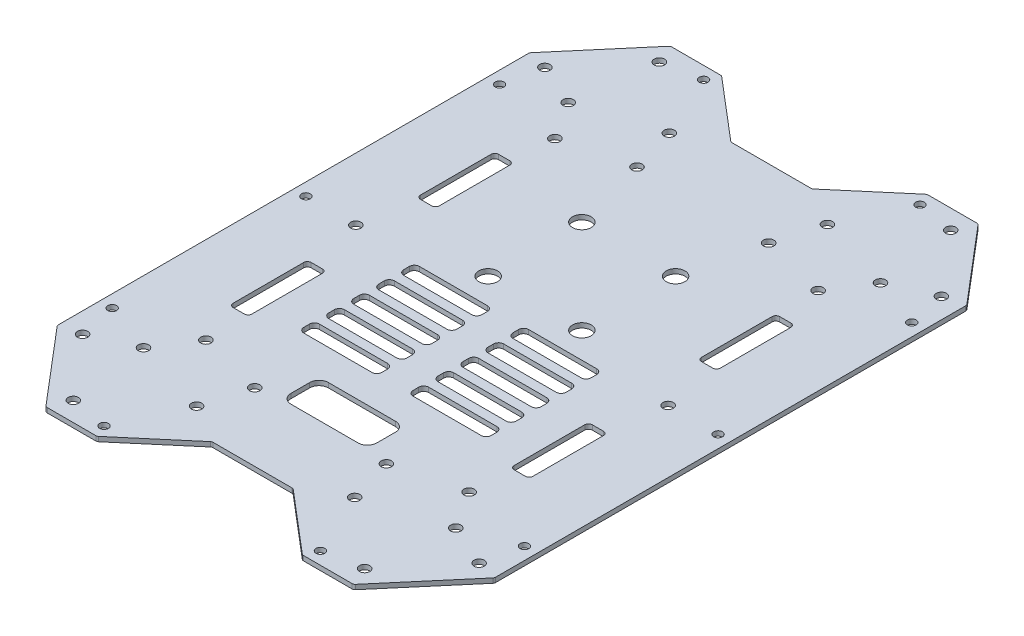
from build123d import *

# Parameters (mm, degrees)
BOSS_EXTRUDE1_DEPTH = 1.5
CUT_EXTRUDE1_DEPTH  = 123.074772169
SKETCH3_R           = 1.65
CUT_EXTRUDE2_DEPTH  = 123.074772169
SKETCH5_R           = 1.65
SKETCH5_R_2         = 3
CUT_EXTRUDE5_DEPTH  = 123.074772169
SKETCH6_R           = 1.65
CUT_EXTRUDE6_DEPTH  = 123.074772169
SKETCH7_R           = 1.4
CUT_EXTRUDE7_DEPTH  = 123.074772169
CUT_EXTRUDE10_DEPTH = 123.074772169
CUT_EXTRUDE11_DEPTH = 123.074772169
FILLET1_R           = 1


with BuildPart() as part:
    # Sketch1 → Boss-Extrude1 (new body)
    with BuildSketch(Plane(origin=(0, 0, 0), x_dir=(1, 0, 0), z_dir=(0, 1, 0))):
        Polygon((49.274817408, 100), (-49.274817408, 100), (-70, 75.618310015), (-70, -75.618310015), (-49.274817408, -100), (49.274817408, -100), (70, -75.618310015), (70, 75.618310015), align=None)
    extrude(amount=BOSS_EXTRUDE1_DEPTH)

    # Sketch2 → Cut-Extrude1 (cut, through all)
    with BuildSketch(Plane(origin=(0, 0, 0), x_dir=(1, 0, 0), z_dir=(0, 1, 0))):
        with BuildLine():
            Line((42, 18.7), (42, 41.3))
            ThreePointArc((42, 41.3), (42.351471863, 42.148528137), (43.2, 42.5))
            Line((43.2, 42.5), (46.8, 42.5))
            ThreePointArc((46.8, 42.5), (47.648528137, 42.148528137), (48, 41.3))
            Line((48, 41.3), (48, 18.7))
            ThreePointArc((48, 18.7), (47.648528137, 17.851471863), (46.8, 17.5))
            Line((46.8, 17.5), (43.2, 17.5))
            ThreePointArc((43.2, 17.5), (42.351471863, 17.851471863), (42, 18.7))
        make_face()
        with BuildLine():
            Line((-48, 18.7), (-48, 41.3))
            ThreePointArc((-48, 41.3), (-47.648528137, 42.148528137), (-46.8, 42.5))
            Line((-46.8, 42.5), (-43.2, 42.5))
            ThreePointArc((-43.2, 42.5), (-42.351471863, 42.148528137), (-42, 41.3))
            Line((-42, 41.3), (-42, 18.7))
            ThreePointArc((-42, 18.7), (-42.351471863, 17.851471863), (-43.2, 17.5))
            Line((-43.2, 17.5), (-46.8, 17.5))
            ThreePointArc((-46.8, 17.5), (-47.648528137, 17.851471863), (-48, 18.7))
        make_face()
        with BuildLine():
            Line((-46.8, -42.5), (-43.2, -42.5))
            ThreePointArc((-43.2, -42.5), (-42.351471863, -42.148528137), (-42, -41.3))
            Line((-42, -41.3), (-42, -18.7))
            ThreePointArc((-42, -18.7), (-42.351471863, -17.851471863), (-43.2, -17.5))
            Line((-43.2, -17.5), (-46.8, -17.5))
            ThreePointArc((-46.8, -17.5), (-47.648528137, -17.851471863), (-48, -18.7))
            Line((-48, -18.7), (-48, -41.3))
            ThreePointArc((-48, -41.3), (-47.648528137, -42.148528137), (-46.8, -42.5))
        make_face()
        with BuildLine():
            Line((43.2, -42.5), (46.8, -42.5))
            ThreePointArc((46.8, -42.5), (47.648528137, -42.148528137), (48, -41.3))
            Line((48, -41.3), (48, -18.7))
            ThreePointArc((48, -18.7), (47.648528137, -17.851471863), (46.8, -17.5))
            Line((46.8, -17.5), (43.2, -17.5))
            ThreePointArc((43.2, -17.5), (42.351471863, -17.851471863), (42, -18.7))
            Line((42, -18.7), (42, -41.3))
            ThreePointArc((42, -41.3), (42.351471863, -42.148528137), (43.2, -42.5))
        make_face()
    extrude(amount=CUT_EXTRUDE1_DEPTH, mode=Mode.SUBTRACT)

    # Sketch3 → Cut-Extrude2 (cut, through all)
    with BuildSketch(Plane(origin=(0, 0, 0), x_dir=(1, 0, 0), z_dir=(0, 1, 0))):
        with Locations(Location((-25.312257667, -75.69371006, 0), (0, 0, 270))):
            Circle(SKETCH3_R)
        with Locations(Location((-46.646236404, -93.828244828, 0), (0, 0, 270))):
            Circle(SKETCH3_R)
        with Locations(Location((-63.48544726, -74.018121715, 0), (0, 0, 270))):
            Circle(SKETCH3_R)
        with Locations(Location((-42.151468523, -55.883586947, 0), (0, 0, 270))):
            Circle(SKETCH3_R)
        with Locations(Location((25.312257667, -75.69371006, 0), (0, 0, 270))):
            Circle(SKETCH3_R)
        with Locations(Location((46.646236404, -93.828244828, 0), (0, 0, 270))):
            Circle(SKETCH3_R)
        with Locations(Location((63.48544726, -74.018121715, 0), (0, 0, 270))):
            Circle(SKETCH3_R)
        with Locations(Location((42.151468523, -55.883586947, 0), (0, 0, 270))):
            Circle(SKETCH3_R)
        with Locations(Location((42.151468523, 55.883586947, 0), (0, 0, 270))):
            Circle(SKETCH3_R)
        with Locations(Location((63.48544726, 74.018121715, 0), (0, 0, 270))):
            Circle(SKETCH3_R)
        with Locations(Location((46.646236404, 93.828244828, 0), (0, 0, 270))):
            Circle(SKETCH3_R)
        with Locations(Location((25.312257667, 75.69371006, 0), (0, 0, 270))):
            Circle(SKETCH3_R)
        with Locations(Location((-25.312257667, 75.69371006, 0), (0, 0, 270))):
            Circle(SKETCH3_R)
        with Locations(Location((-42.151468523, 55.883586947, 0), (0, 0, 270))):
            Circle(SKETCH3_R)
        with Locations(Location((-63.48544726, 74.018121715, 0), (0, 0, 270))):
            Circle(SKETCH3_R)
        with Locations(Location((-46.646236404, 93.828244828, 0), (0, 0, 270))):
            Circle(SKETCH3_R)
    extrude(amount=CUT_EXTRUDE2_DEPTH, mode=Mode.SUBTRACT)

    # Sketch5 → Cut-Extrude5 (cut, through all)
    with BuildSketch(Plane(origin=(0, 0, 0), x_dir=(1, 0, 0), z_dir=(0, 1, 0))):
        with Locations(Location((21.059, -61.294231, 0), (0, 0, 270))):
            Circle(SKETCH5_R)
        with Locations(Location((-21.105, -61.294231, 0), (0, 0, 270))):
            Circle(SKETCH5_R)
        with Locations(Location((21.059, 61.133769, 0), (0, 0, 270))):
            Circle(SKETCH5_R)
        with Locations(Location((-21.105, 61.133769, 0), (0, 0, 270))):
            Circle(SKETCH5_R)
        with Locations(Location((15.358, 37.017769, 0), (0, 0, 270))):
            Circle(SKETCH5_R_2)
        with Locations(Location((-14.642, 37.017769, 0), (0, 0, 270))):
            Circle(SKETCH5_R_2)
        with Locations(Location((-14.642, 7.017769, 0), (0, 0, 270))):
            Circle(SKETCH5_R_2)
        with Locations(Location((15.358, 7.017769, 0), (0, 0, 270))):
            Circle(SKETCH5_R_2)
    extrude(amount=CUT_EXTRUDE5_DEPTH, mode=Mode.SUBTRACT)

    # Sketch6 → Cut-Extrude6 (cut, through all)
    with BuildSketch(Plane(origin=(0, 0, 0), x_dir=(1, 0, 0), z_dir=(0, 1, 0))):
        with Locations(Location((-50, 0, 0), (0, 0, 270))):
            Circle(SKETCH6_R)
        with Locations(Location((-50, -68, 0), (0, 0, 270))):
            Circle(SKETCH6_R)
        with Locations(Location((-50, 68, 0), (0, 0, 270))):
            Circle(SKETCH6_R)
        with Locations(Location((50, 68, 0), (0, 0, 90))):
            Circle(SKETCH6_R)
        with Locations(Location((50, -68, 0), (0, 0, 90))):
            Circle(SKETCH6_R)
        with Locations(Location((50, 0, 0), (0, 0, 90))):
            Circle(SKETCH6_R)
    extrude(amount=CUT_EXTRUDE6_DEPTH, mode=Mode.SUBTRACT)

    # Sketch7 → Cut-Extrude7 (cut, through all)
    with BuildSketch(Plane(origin=(0, 0, 0), x_dir=(1, 0, 0), z_dir=(0, 1, 0))):
        with Locations(Location((-34.646236404, -96, 0), (0, 0, 270))):
            Circle(SKETCH7_R)
        with Locations(Location((-66, -62.018121715, 0), (0, 0, 270))):
            Circle(SKETCH7_R)
        with Locations(Location((-66, 0, 0), (0, 0, 270))):
            Circle(SKETCH7_R)
        with Locations(Location((-66, 62.018121715, 0), (0, 0, 270))):
            Circle(SKETCH7_R)
        with Locations(Location((-34.646236404, 96, 0), (0, 0, 270))):
            Circle(SKETCH7_R)
        with Locations(Location((0, 96, 0), (0, 0, 270))):
            Circle(SKETCH7_R)
        with Locations(Location((0, -96, 0), (0, 0, 270))):
            Circle(SKETCH7_R)
        with Locations(Location((34.646236404, 96, 0), (0, 0, 90))):
            Circle(SKETCH7_R)
        with Locations(Location((66, 62.018121715, 0), (0, 0, 90))):
            Circle(SKETCH7_R)
        with Locations(Location((66, 0, 0), (0, 0, 90))):
            Circle(SKETCH7_R)
        with Locations(Location((66, -62.018121715, 0), (0, 0, 90))):
            Circle(SKETCH7_R)
        with Locations(Location((34.646236404, -96, 0), (0, 0, 90))):
            Circle(SKETCH7_R)
    extrude(amount=CUT_EXTRUDE7_DEPTH, mode=Mode.SUBTRACT)

    # Sketch10 → Cut-Extrude10 (cut, through all)
    with BuildSketch(Plane(origin=(0, 0, 0), x_dir=(1, 0, 0), z_dir=(0, 1, 0))):
        with BuildLine():
            Line((-5, -10.869802471), (-5, -12.669802471))
            ThreePointArc((-5, -12.669802471), (-5.46862915, -13.801173321), (-6.6, -14.269802471))
            Line((-6.6, -14.269802471), (-28.4, -14.269802471))
            ThreePointArc((-28.4, -14.269802471), (-29.53137085, -13.801173321), (-30, -12.669802471))
            Line((-30, -12.669802471), (-30, -10.869802471))
            ThreePointArc((-30, -10.869802471), (-29.53137085, -9.738431622), (-28.4, -9.269802471))
            Line((-28.4, -9.269802471), (-6.6, -9.269802471))
            ThreePointArc((-6.6, -9.269802471), (-5.46862915, -9.738431622), (-5, -10.869802471))
        make_face()
        with BuildLine():
            Line((-10.75, -60.040539818), (10.75, -60.040539818))
            ThreePointArc((10.75, -60.040539818), (12.871320344, -59.161860162), (13.75, -57.040539818))
            Line((13.75, -57.040539818), (13.75, -51.040539818))
            ThreePointArc((13.75, -51.040539818), (12.871320344, -48.919219475), (10.75, -48.040539818))
            Line((10.75, -48.040539818), (-10.75, -48.040539818))
            ThreePointArc((-10.75, -48.040539818), (-12.871320344, -48.919219475), (-13.75, -51.040539818))
            Line((-13.75, -51.040539818), (-13.75, -57.040539818))
            ThreePointArc((-13.75, -57.040539818), (-12.871320344, -59.161860162), (-10.75, -60.040539818))
        make_face()
        with BuildLine():
            Line((-6.6, -1.269802471), (-28.4, -1.269802471))
            ThreePointArc((-28.4, -1.269802471), (-29.53137085, -1.738431622), (-30, -2.869802471))
            Line((-30, -2.869802471), (-30, -4.669802471))
            ThreePointArc((-30, -4.669802471), (-29.53137085, -5.801173321), (-28.4, -6.269802471))
            Line((-28.4, -6.269802471), (-6.6, -6.269802471))
            ThreePointArc((-6.6, -6.269802471), (-5.46862915, -5.801173321), (-5, -4.669802471))
            Line((-5, -4.669802471), (-5, -2.869802471))
            ThreePointArc((-5, -2.869802471), (-5.46862915, -1.738431622), (-6.6, -1.269802471))
        make_face()
        with BuildLine():
            Line((-5, -18.869802471), (-5, -20.669802471))
            ThreePointArc((-5, -20.669802471), (-5.46862915, -21.801173321), (-6.6, -22.269802471))
            Line((-6.6, -22.269802471), (-28.4, -22.269802471))
            ThreePointArc((-28.4, -22.269802471), (-29.53137085, -21.801173321), (-30, -20.669802471))
            Line((-30, -20.669802471), (-30, -18.869802471))
            ThreePointArc((-30, -18.869802471), (-29.53137085, -17.738431622), (-28.4, -17.269802471))
            Line((-28.4, -17.269802471), (-6.6, -17.269802471))
            ThreePointArc((-6.6, -17.269802471), (-5.46862915, -17.738431622), (-5, -18.869802471))
        make_face()
        with BuildLine():
            Line((-5, -26.869802471), (-5, -28.669802471))
            ThreePointArc((-5, -28.669802471), (-5.46862915, -29.801173321), (-6.6, -30.269802471))
            Line((-6.6, -30.269802471), (-28.4, -30.269802471))
            ThreePointArc((-28.4, -30.269802471), (-29.53137085, -29.801173321), (-30, -28.669802471))
            Line((-30, -28.669802471), (-30, -26.869802471))
            ThreePointArc((-30, -26.869802471), (-29.53137085, -25.738431622), (-28.4, -25.269802471))
            Line((-28.4, -25.269802471), (-6.6, -25.269802471))
            ThreePointArc((-6.6, -25.269802471), (-5.46862915, -25.738431622), (-5, -26.869802471))
        make_face()
        with BuildLine():
            Line((-5, -34.869802471), (-5, -36.669802471))
            ThreePointArc((-5, -36.669802471), (-5.46862915, -37.801173321), (-6.6, -38.269802471))
            Line((-6.6, -38.269802471), (-28.4, -38.269802471))
            ThreePointArc((-28.4, -38.269802471), (-29.53137085, -37.801173321), (-30, -36.669802471))
            Line((-30, -36.669802471), (-30, -34.869802471))
            ThreePointArc((-30, -34.869802471), (-29.53137085, -33.738431622), (-28.4, -33.269802471))
            Line((-28.4, -33.269802471), (-6.6, -33.269802471))
            ThreePointArc((-6.6, -33.269802471), (-5.46862915, -33.738431622), (-5, -34.869802471))
        make_face()
        with BuildLine():
            Line((6.6, -38.269802471), (28.4, -38.269802471))
            ThreePointArc((28.4, -38.269802471), (29.53137085, -37.801173321), (30, -36.669802471))
            Line((30, -36.669802471), (30, -34.869802471))
            ThreePointArc((30, -34.869802471), (29.53137085, -33.738431622), (28.4, -33.269802471))
            Line((28.4, -33.269802471), (6.6, -33.269802471))
            ThreePointArc((6.6, -33.269802471), (5.46862915, -33.738431622), (5, -34.869802471))
            Line((5, -34.869802471), (5, -36.669802471))
            ThreePointArc((5, -36.669802471), (5.46862915, -37.801173321), (6.6, -38.269802471))
        make_face()
        with BuildLine():
            Line((6.6, -30.269802471), (28.4, -30.269802471))
            ThreePointArc((28.4, -30.269802471), (29.53137085, -29.801173321), (30, -28.669802471))
            Line((30, -28.669802471), (30, -26.869802471))
            ThreePointArc((30, -26.869802471), (29.53137085, -25.738431622), (28.4, -25.269802471))
            Line((28.4, -25.269802471), (6.6, -25.269802471))
            ThreePointArc((6.6, -25.269802471), (5.46862915, -25.738431622), (5, -26.869802471))
            Line((5, -26.869802471), (5, -28.669802471))
            ThreePointArc((5, -28.669802471), (5.46862915, -29.801173321), (6.6, -30.269802471))
        make_face()
        with BuildLine():
            Line((6.6, -22.269802471), (28.4, -22.269802471))
            ThreePointArc((28.4, -22.269802471), (29.53137085, -21.801173321), (30, -20.669802471))
            Line((30, -20.669802471), (30, -18.869802471))
            ThreePointArc((30, -18.869802471), (29.53137085, -17.738431622), (28.4, -17.269802471))
            Line((28.4, -17.269802471), (6.6, -17.269802471))
            ThreePointArc((6.6, -17.269802471), (5.46862915, -17.738431622), (5, -18.869802471))
            Line((5, -18.869802471), (5, -20.669802471))
            ThreePointArc((5, -20.669802471), (5.46862915, -21.801173321), (6.6, -22.269802471))
        make_face()
        with BuildLine():
            Line((6.6, -14.269802471), (28.4, -14.269802471))
            ThreePointArc((28.4, -14.269802471), (29.53137085, -13.801173321), (30, -12.669802471))
            Line((30, -12.669802471), (30, -10.869802471))
            ThreePointArc((30, -10.869802471), (29.53137085, -9.738431622), (28.4, -9.269802471))
            Line((28.4, -9.269802471), (6.6, -9.269802471))
            ThreePointArc((6.6, -9.269802471), (5.46862915, -9.738431622), (5, -10.869802471))
            Line((5, -10.869802471), (5, -12.669802471))
            ThreePointArc((5, -12.669802471), (5.46862915, -13.801173321), (6.6, -14.269802471))
        make_face()
        with BuildLine():
            Line((30, -2.869802471), (30, -4.669802471))
            ThreePointArc((30, -4.669802471), (29.53137085, -5.801173321), (28.4, -6.269802471))
            Line((28.4, -6.269802471), (6.6, -6.269802471))
            ThreePointArc((6.6, -6.269802471), (5.46862915, -5.801173321), (5, -4.669802471))
            Line((5, -4.669802471), (5, -2.869802471))
            ThreePointArc((5, -2.869802471), (5.46862915, -1.738431622), (6.6, -1.269802471))
            Line((6.6, -1.269802471), (28.4, -1.269802471))
            ThreePointArc((28.4, -1.269802471), (29.53137085, -1.738431622), (30, -2.869802471))
        make_face()
    extrude(amount=CUT_EXTRUDE10_DEPTH, mode=Mode.SUBTRACT)

    # Sketch11 → Cut-Extrude11 (cut, through all)
    with BuildSketch(Plane(origin=(0, 0, 0), x_dir=(1, 0, 0), z_dir=(0, 1, 0))):
        Polygon((-12.999369656, 83.093521), (-38.173311785, 104.492142158), (-38.173311785, 105.890093506), (38.173311785, 105.890093506), (38.173311785, 104.492142158), (12.999369656, 83.093521), align=None)
        Polygon((-12.999369656, -83.093521), (12.999369656, -83.093521), (38.173311785, -104.492142158), (38.173311785, -105.890093506), (-38.173311785, -105.890093506), (-38.173311785, -104.492142158), align=None)
    extrude(amount=CUT_EXTRUDE11_DEPTH, mode=Mode.SUBTRACT)

    # Fillet1
    fillet1_edges = [part.edges().sort_by_distance(p)[0] for p in [
        (70, 0.75, -75.618310015),
        (70, 0.75, 75.618310015),
        (49.274817408, 0.75, 100),
        (-49.274817408, 0.75, 100),
        (-70, 0.75, 75.618310015),
        (-70, 0.75, -75.618310015),
        (-49.274817408, 0.75, -100),
        (49.274817408, 0.75, -100),
        (-32.888628912, 0.75, 100),
        (32.888628912, 0.75, 100),
        (-32.888628912, 0.75, -100),
        (32.888628912, 0.75, -100),
        (12.999369656, 0.75, -83.093521),
        (-12.999369656, 0.75, -83.093521),
        (-12.999369656, 0.75, 83.093521),
        (12.999369656, 0.75, 83.093521),
    ]]
    fillet(fillet1_edges, radius=FILLET1_R)


solid = part.part
